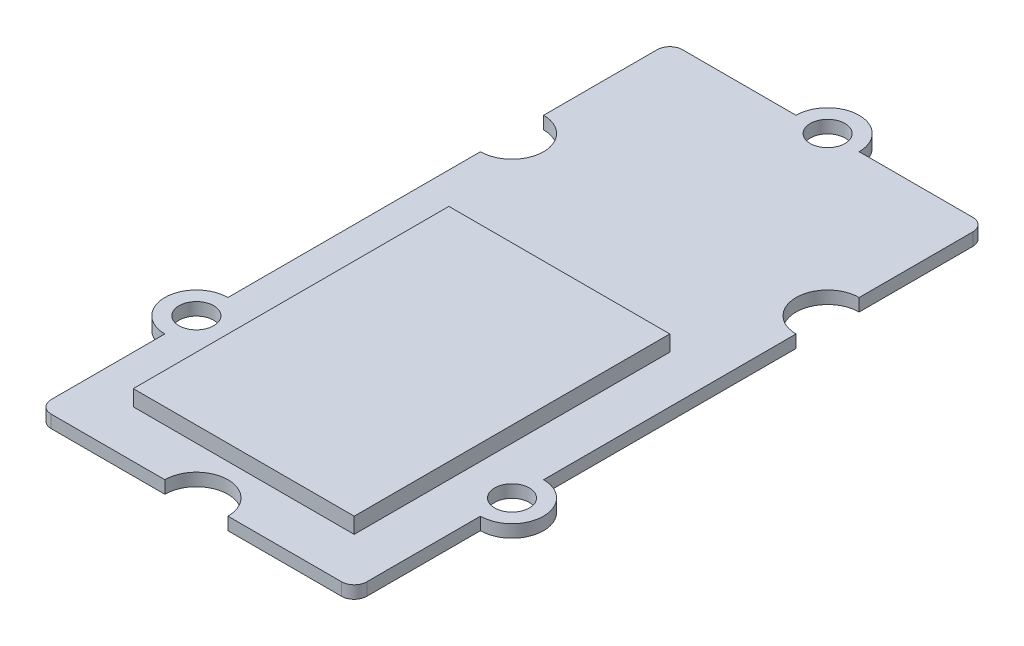
from build123d import *

# Parameters (mm, degrees)
SKETCH1_R      = 1.1
BOARD_DEPTH    = 0.8
ESQUISSE1_W    = 14
ESQUISSE1_H    = 20
CAPTEURS_DEPTH = 1


with BuildPart() as part:
    # Sketch1 → Board (new body)
    with BuildSketch(Plane(origin=(0, 0, 0), x_dir=(1, 0, 0), z_dir=(0, 1, 0))):
        with BuildLine():
            Line((0.8, 0), (8, 0))
            ThreePointArc((8, 0), (10, 2), (12, 0))
            Line((12, 0), (19.2, 0))
            ThreePointArc((19.2, 0), (19.765685425, 0.234314575), (20, 0.8))
            Line((20, 0.8), (20, 8))
            ThreePointArc((20, 8), (22, 10), (20, 12))
            Line((20, 12), (20, 28))
            ThreePointArc((20, 28), (18, 30), (20, 32))
            Line((20, 32), (20, 39.2))
            ThreePointArc((20, 39.2), (19.765685425, 39.765685425), (19.2, 40))
            Line((19.2, 40), (12, 40))
            ThreePointArc((12, 40), (10, 42), (8, 40))
            Line((8, 40), (0.8, 40))
            ThreePointArc((0.8, 40), (0.234314575, 39.765685425), (0, 39.2))
            Line((0, 39.2), (0, 32))
            ThreePointArc((0, 32), (2, 30), (0, 28))
            Line((0, 28), (0, 12))
            ThreePointArc((0, 12), (-2, 10), (0, 8))
            Line((0, 8), (0, 0.8))
            ThreePointArc((0, 0.8), (0.234314575, 0.234314575), (0.8, 0))
        make_face()
        with Locations(Location((10, 40, 0), (0, 0, 270))):
            Circle(SKETCH1_R, mode=Mode.SUBTRACT)
        with Locations(Location((0, 10, 0), (0, 0, 270))):
            Circle(SKETCH1_R, mode=Mode.SUBTRACT)
        with Locations(Location((20, 10, 0), (0, 0, 270))):
            Circle(SKETCH1_R, mode=Mode.SUBTRACT)
    extrude(amount=BOARD_DEPTH)

    # Esquisse1 → Capteurs (add)
    with BuildSketch(Plane(origin=(0, 0.8, 0), x_dir=(1, 0, 0), z_dir=(0, 1, 0))):
        with Locations((10, 13)):
            Rectangle(ESQUISSE1_W, ESQUISSE1_H)
    extrude(amount=CAPTEURS_DEPTH)


solid = part.part
